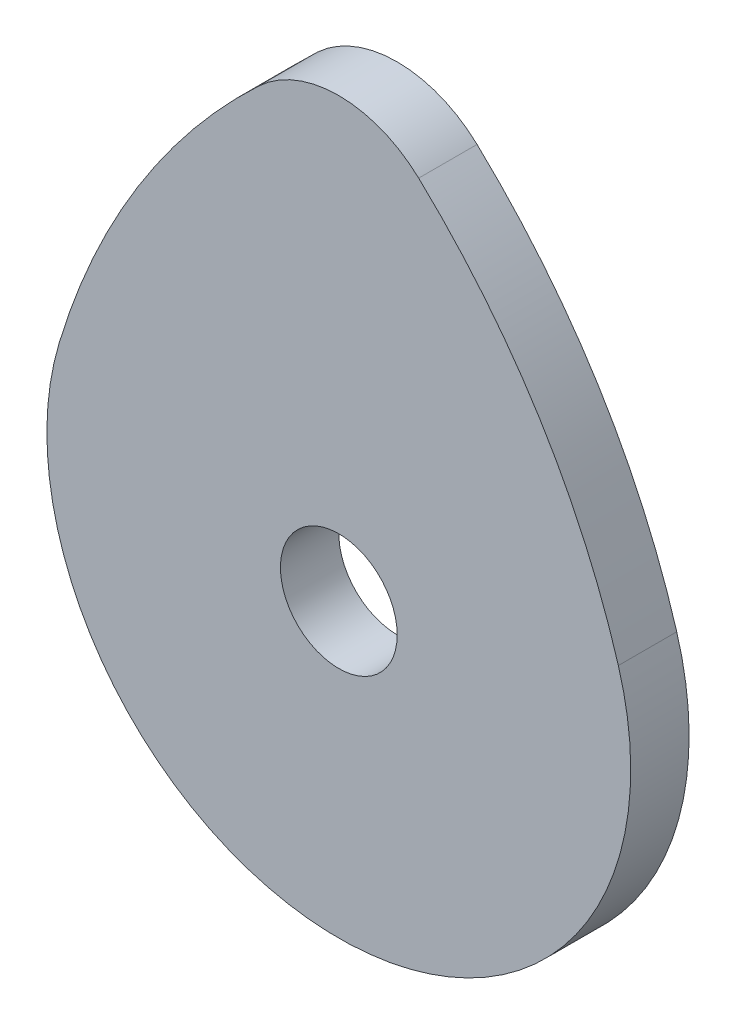
from build123d import *

# Parameters (mm, degrees)
SKETCH1_R           = 50.8
BOSS_EXTRUDE1_DEPTH = 50.8


with BuildPart() as part:
    # Sketch1 → Boss-Extrude1 (new body)
    with BuildSketch(Plane.XY):
        with BuildLine():
            ThreePointArc((-243.247380948, 73.121212121), (0, -254), (243.247380948, 73.121212121))
            ThreePointArc((243.247380948, 73.121212121), (174.897670874, 224.794944599), (69.499251699, 353.510822511))
            ThreePointArc((69.499251699, 353.510822511), (0, 381), (-69.499251699, 353.510822511))
            ThreePointArc((-69.499251699, 353.510822511), (-174.897670874, 224.794944599), (-243.247380948, 73.121212121))
        make_face()
        Circle(SKETCH1_R, mode=Mode.SUBTRACT)
    extrude(amount=BOSS_EXTRUDE1_DEPTH)


solid = part.part
